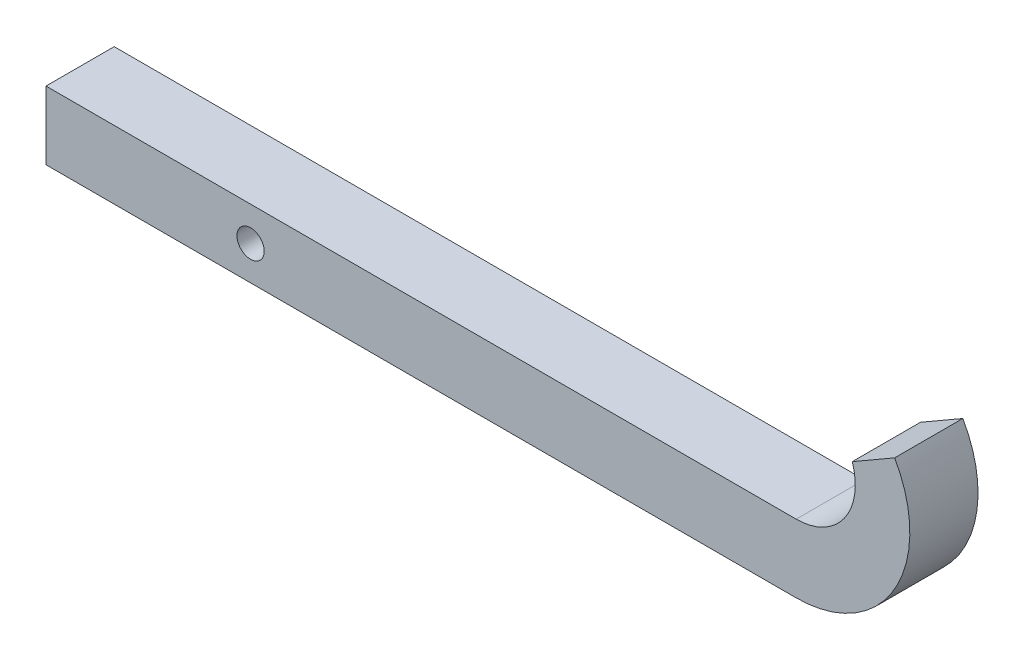
from build123d import *

# Parameters (mm, degrees)
SALIENTE_EXTRUIR1_DEPTH = 7.5
CROQUIS2_R              = 3
CORTAR_EXTRUIR1_DEPTH   = 170.871274794


with BuildPart() as part:
    # Croquis1 → Saliente-Extruir1 (new, symmetric)
    with BuildSketch(Plane.XY):
        with BuildLine():
            Line((12.330243842, 32.118869601), (21.650635095, 37.5))
            ThreePointArc((21.650635095, 37.5), (21.650635095, 12.5), (0, 0))
            Line((0, 0), (-165, 0))
            Line((-165, 0), (-165, 15))
            Line((-165, 15), (0, 15))
            ThreePointArc((0, 15), (10.548585327, 20.402148489), (12.330243842, 32.118869601))
        make_face()
    extrude(amount=SALIENTE_EXTRUIR1_DEPTH, both=True)

    # Croquis2 → Cortar-Extruir1 (cut, through all)
    with BuildSketch(Plane.XY.offset(7.5)):
        with Locations((-120, 7.5)):
            Circle(CROQUIS2_R)
    extrude(amount=-CORTAR_EXTRUIR1_DEPTH, mode=Mode.SUBTRACT)


solid = part.part
